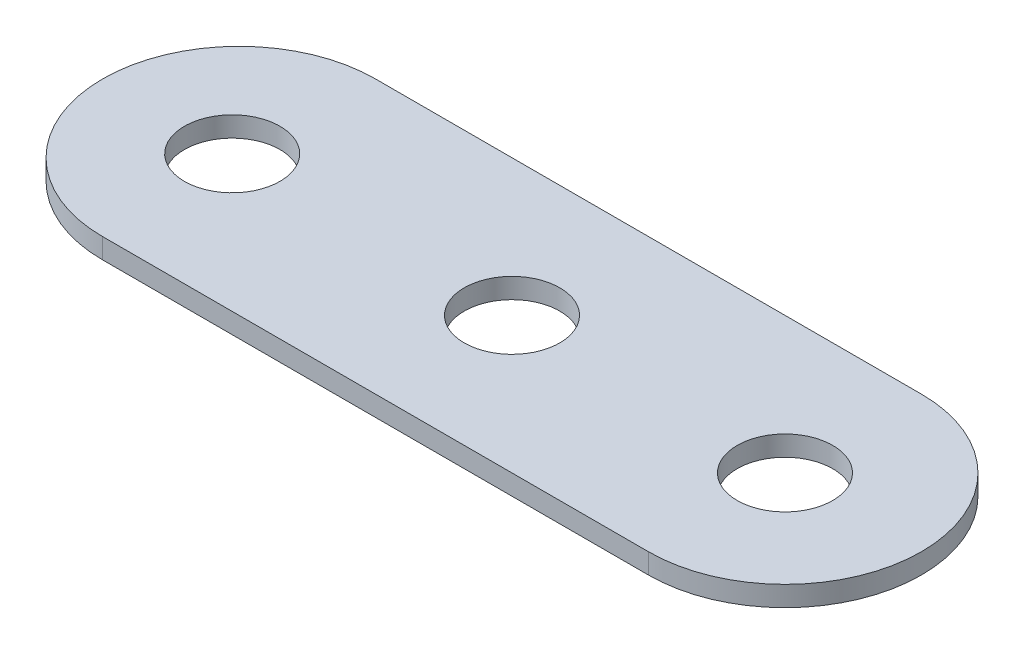
from build123d import *

# Parameters (mm, degrees)
SKETCH1_R = 2.2225
BAR_DEPTH = 0.9398


with BuildPart() as part:
    # Sketch1 → Bar (new body)
    with BuildSketch(Plane(origin=(0, 0, 0), x_dir=(-1, 0, 0), z_dir=(0, 1, 0))):
        with BuildLine():
            Line((37.465, -6.35), (62.865, -6.35))
            ThreePointArc((62.865, -6.35), (69.215, 0), (62.865, 6.35))
            Line((62.865, 6.35), (37.465, 6.35))
            ThreePointArc((37.465, 6.35), (31.115, 0), (37.465, -6.35))
        make_face()
        with Locations((37.465, 0)):
            Circle(SKETCH1_R, mode=Mode.SUBTRACT)
        with Locations((50.165, 0)):
            Circle(SKETCH1_R, mode=Mode.SUBTRACT)
        with Locations((63.1825, 0)):
            Circle(SKETCH1_R, mode=Mode.SUBTRACT)
    extrude(amount=BAR_DEPTH)


solid = part.part
